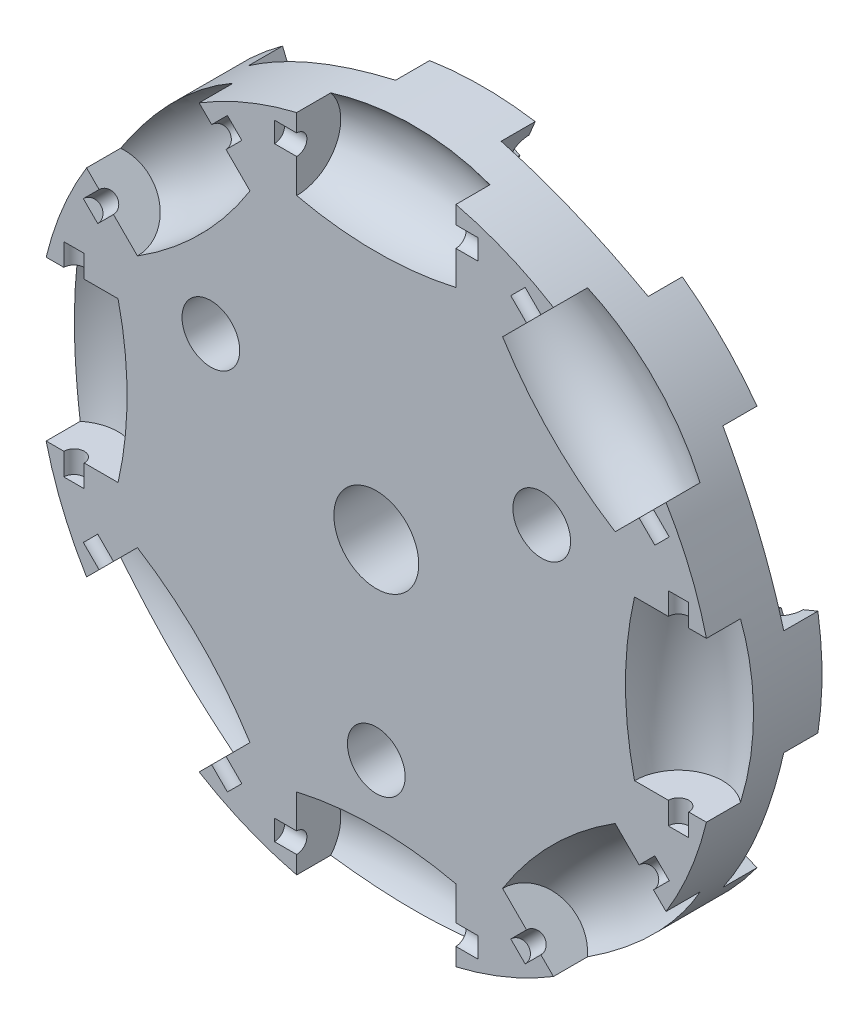
from build123d import *

# Parameters (mm, degrees)
SKETCH1_R           = 25.4
BOSS_EXTRUDE1_DEPTH = 3.96875
SKETCH6_R           = 0.762
CUT_EXTRUDE2_DEPTH  = 7.62
SKETCH10_R          = 0.889
CUT_EXTRUDE3_DEPTH  = 7.9375
CIRPATTERN1_COUNT   = 8
SKETCH16_R          = 2.159
CUT_EXTRUDE7_DEPTH  = 37.787551128
SKETCH17_R          = 3.175
CUT_EXTRUDE8_DEPTH  = 37.787551128


with BuildPart() as part:
    # Sketch1 → Boss-Extrude1 (new, symmetric)
    with BuildSketch(Plane.XY):
        Circle(SKETCH1_R)
    extrude(amount=BOSS_EXTRUDE1_DEPTH, both=True)

    # Sketch5 → Cut-Revolve5 (revolve, cut)
    with BuildSketch(Plane.XY.offset(3.96875)):
        with BuildLine():
            Line((-5.953125, 25.899375288), (-5.953125, 22.606))
            Line((-5.953125, 22.606), (5.953125, 22.606))
            Line((5.953125, 22.606), (5.953125, 25.899375288))
            ThreePointArc((5.953125, 25.899375288), (0, 26.57475), (-5.953125, 25.899375288))
        make_face()
    cut_revolve5 = revolve(axis=Axis((-5.953125, 22.606, 3.96875), (1, 0, 0)), mode=Mode.SUBTRACT)

    # Sketch8 → Cut-Revolve6 (revolve, cut)
    with BuildSketch(Plane.XY.offset(-3.96875)):
        with BuildLine():
            Line((4.411291489, 26.206065041), (3.15097133, 23.16338302))
            Line((3.15097133, 23.16338302), (14.150912014, 18.607058404))
            Line((14.150912014, 18.607058404), (15.411232173, 21.649740425))
            ThreePointArc((15.411232173, 21.649740425), (10.169716544, 24.551867607), (4.411291489, 26.206065041))
        make_face()
    cut_revolve6 = revolve(axis=Axis((3.15097133, 23.16338302, -3.96875), (-0.9238795325112866, 0.38268343236509017, 0)), mode=Mode.SUBTRACT)

    # Sketch6 → Cut-Extrude2 (cut, symmetric)
    with BuildSketch(Plane(origin=(0, 0, 0), x_dir=(0, 0, -1), z_dir=(1, 0, 0))):
        with Locations((-3.96875, 22.606)):
            Circle(SKETCH6_R)
    cut_extrude2 = extrude(amount=CUT_EXTRUDE2_DEPTH, both=True, mode=Mode.SUBTRACT)

    # Sketch10 → Cut-Extrude3 (cut, symmetric)
    with BuildSketch(Plane(origin=(0, 0, 0), x_dir=(0, 0, -1), z_dir=(0.9238795325112866, -0.38268343236509017, 0))):
        with Locations((3.96875, 22.606)):
            Circle(SKETCH10_R)
    cut_extrude3 = extrude(amount=CUT_EXTRUDE3_DEPTH, both=True, mode=Mode.SUBTRACT)

    # CirPattern1: Cut-Revolve5, Cut-Revolve6, Cut-Extrude2, Cut-Extrude3 ×8 about axis
    cirpattern1_axis = Axis((0, 0, 3.96875), (0, 0, -1))
    add([cut_revolve5.rotate(cirpattern1_axis, i * 360 / CIRPATTERN1_COUNT) for i in range(1, CIRPATTERN1_COUNT)], mode=Mode.SUBTRACT)
    add([cut_revolve6.rotate(cirpattern1_axis, i * 360 / CIRPATTERN1_COUNT) for i in range(1, CIRPATTERN1_COUNT)], mode=Mode.SUBTRACT)
    add([cut_extrude2.rotate(cirpattern1_axis, i * 360 / CIRPATTERN1_COUNT) for i in range(1, CIRPATTERN1_COUNT)], mode=Mode.SUBTRACT)
    add([cut_extrude3.rotate(cirpattern1_axis, i * 360 / CIRPATTERN1_COUNT) for i in range(1, CIRPATTERN1_COUNT)], mode=Mode.SUBTRACT)

    # Sketch16 → Cut-Extrude7 (cut, through all)
    with BuildSketch(Plane.XY.offset(3.96875)):
        with Locations((0, -14.2875)):
            Circle(SKETCH16_R)
        with Locations((-12.373337957, 7.14375)):
            Circle(SKETCH16_R)
        with Locations((12.373337957, 7.14375)):
            Circle(SKETCH16_R)
    extrude(amount=-CUT_EXTRUDE7_DEPTH, mode=Mode.SUBTRACT)

    # Sketch17 → Cut-Extrude8 (cut, through all)
    with BuildSketch(Plane.XY.offset(3.96875)):
        Circle(SKETCH17_R)
    extrude(amount=-CUT_EXTRUDE8_DEPTH, mode=Mode.SUBTRACT)


solid = part.part
